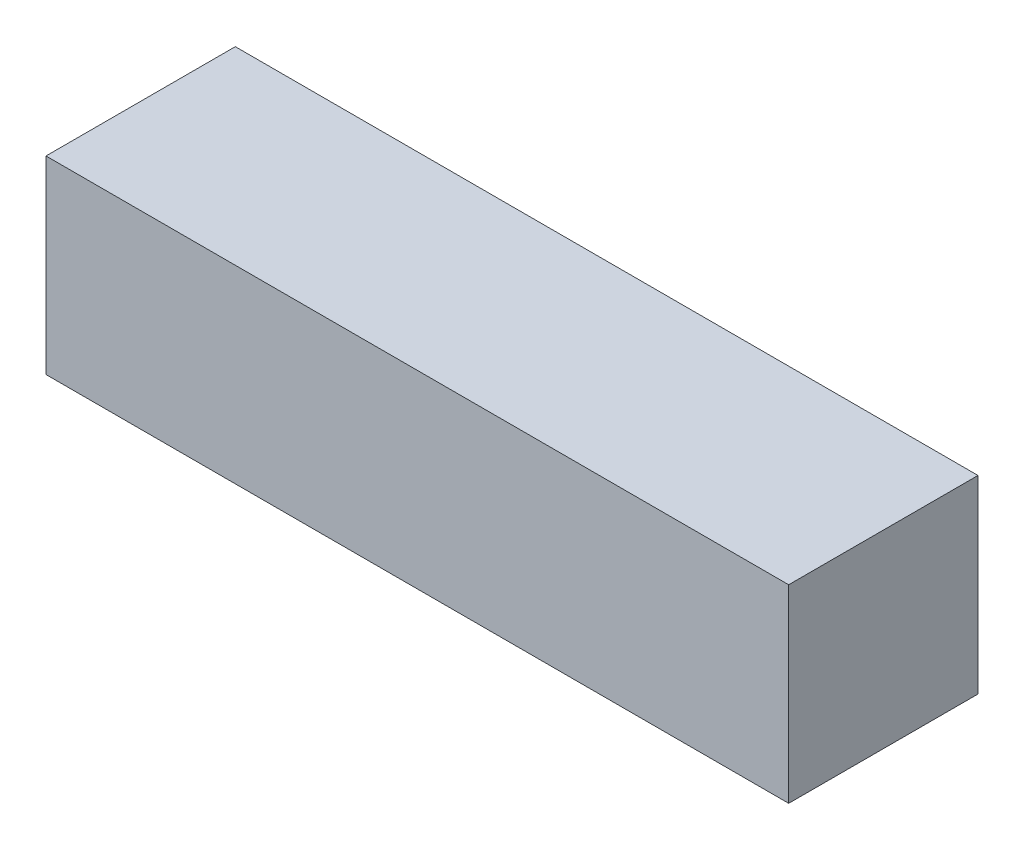
from build123d import *

# Parameters (mm, degrees)
SKETCH1_W           = 102
SKETCH1_H           = 26
BOSS_EXTRUDE1_DEPTH = 26


with BuildPart() as part:
    # Sketch1 → Boss-Extrude1 (new body)
    with BuildSketch(Plane(origin=(0, 0, 0), x_dir=(1, 0, 0), z_dir=(0, 1, 0))):
        with Locations((51, 13)):
            Rectangle(SKETCH1_W, SKETCH1_H)
    extrude(amount=BOSS_EXTRUDE1_DEPTH)


solid = part.part
